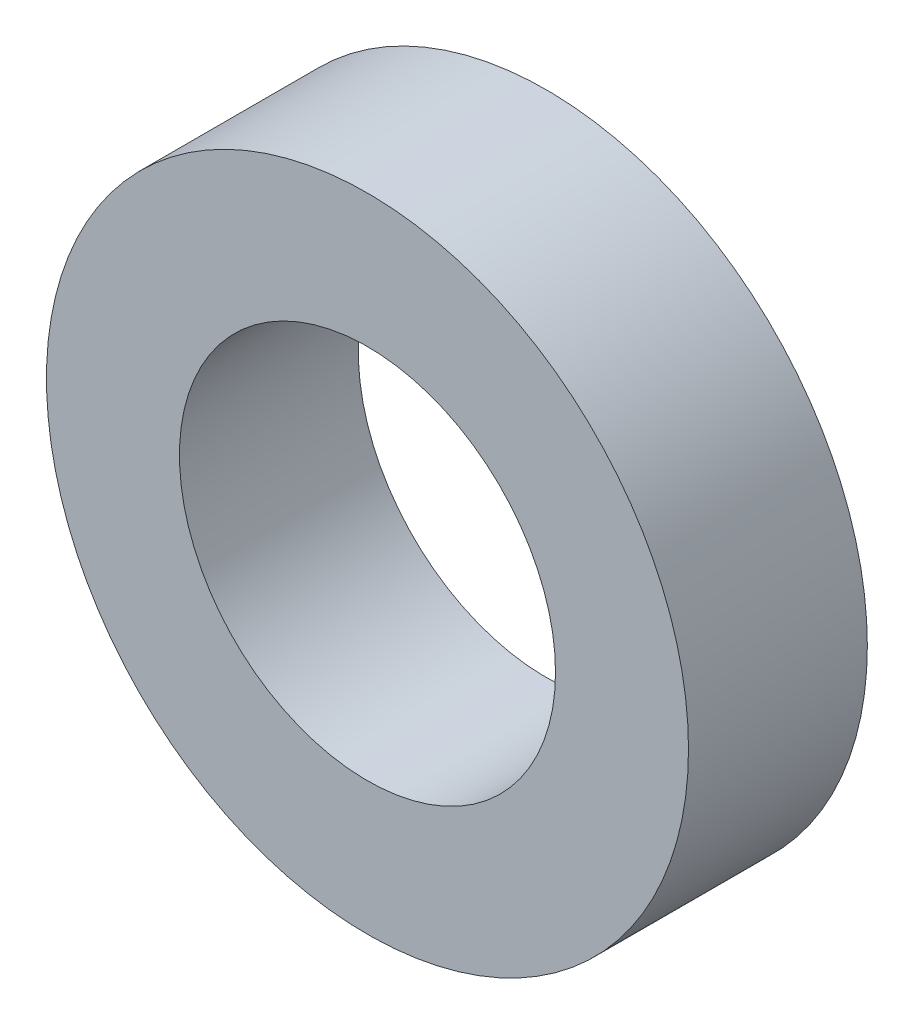
from build123d import *

# Parameters (mm, degrees)
SKETCH1_R           = 14.224
BOSS_EXTRUDE1_DEPTH = 7.9248
SKETCH2_R           = 8.3312
CUT_EXTRUDE1_DEPTH  = 22.620518195


with BuildPart() as part:
    # Sketch1 → Boss-Extrude1 (new body)
    with BuildSketch(Plane.XY):
        Circle(SKETCH1_R)
    extrude(amount=BOSS_EXTRUDE1_DEPTH)

    # Sketch2 → Cut-Extrude1 (cut, through all)
    with BuildSketch(Plane.XY):
        Circle(SKETCH2_R)
    extrude(amount=CUT_EXTRUDE1_DEPTH, mode=Mode.SUBTRACT)


solid = part.part
